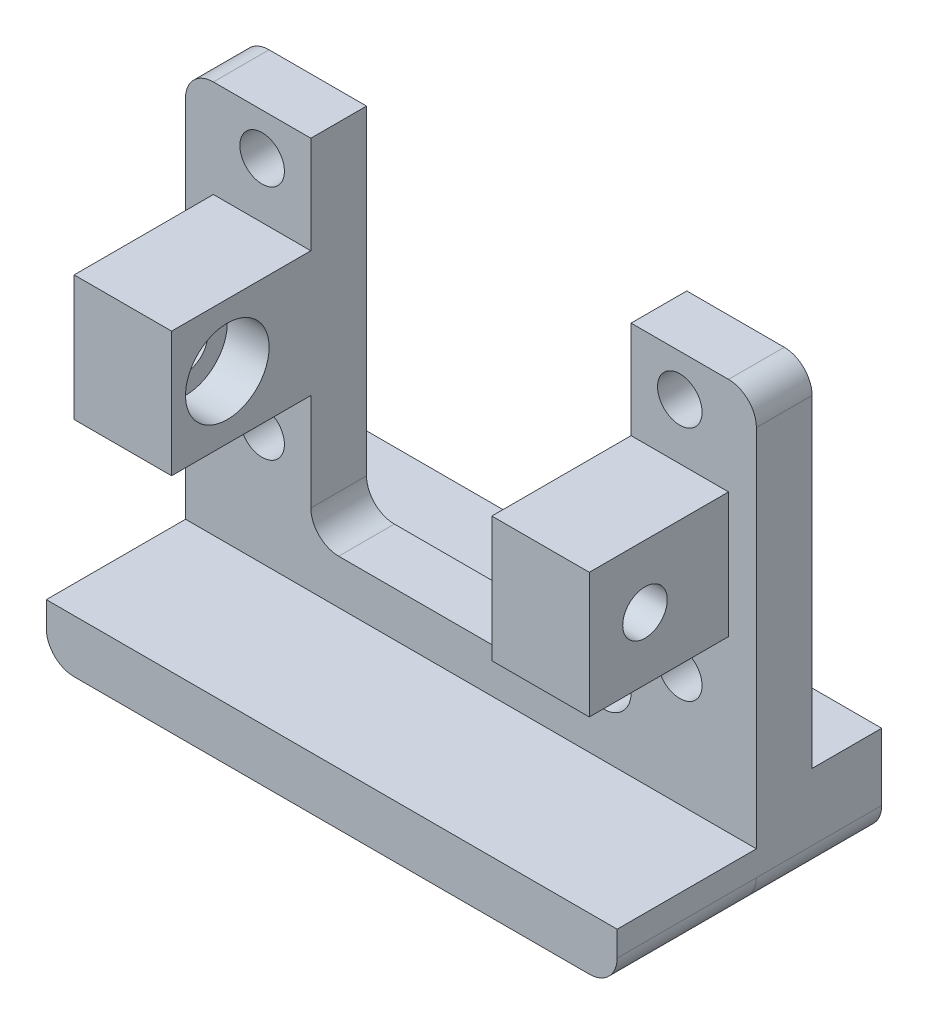
from build123d import *

# Parameters (mm, degrees)
EXTRUDE_5_DEPTH          = 3
EXTRUDE_5_DEPTH_BACK     = 1
SKETCH_1_R               = 1.6
SKETCH_6_W               = 7
SKETCH_6_H               = 9
EXTRUDE_6_DEPTH          = 10
CUT_EXTRUDE_3_DEPTH      = 48.647140523
CUT_EXTRUDE_3_DEPTH_BACK = 48.647140523
SKETCH_7_R               = 1.6
FILLET_1_R               = 2
EXTRUDE_START            = 5
EXTRUDE_7_DEPTH          = 5
SKETCH_9_R               = 3
CUT_EXTRUDE_4_DEPTH      = 3
CUT_EXTRUDE_START        = -3
SKETCH_10_R              = 3
CUT_EXTRUDE_5_DEPTH      = 3
SKETCH_11_W              = 41
SKETCH_11_H              = 3.8
EXTRUDE_8_DEPTH          = 10
FILLET_2_R               = 2


with BuildPart() as part:
    # 草图1 → 凸台-拉伸5 (new, two sides: drawn at the far end of the back side and taken through both)
    with BuildSketch(Plane.XY.offset(-EXTRUDE_5_DEPTH_BACK)):
        with BuildLine():
            Line((-11.5, -13.5), (-11.5, 11.5))
            Line((-11.5, 11.5), (-18.5, 11.5))
            ThreePointArc((-18.5, 11.5), (-19.914213562, 10.914213562), (-20.5, 9.5))
            Line((-20.5, 9.5), (-20.5, -18.5))
            ThreePointArc((-20.5, -18.5), (-19.914213562, -19.914213562), (-18.5, -20.5))
            Line((-18.5, -20.5), (18.5, -20.5))
            ThreePointArc((18.5, -20.5), (19.914213562, -19.914213562), (20.5, -18.5))
            Line((20.5, -18.5), (20.5, 9.5))
            ThreePointArc((20.5, 9.5), (19.914213562, 10.914213562), (18.5, 11.5))
            Line((18.5, 11.5), (11.5, 11.5))
            Line((11.5, 11.5), (11.5, -13.5))
            Line((11.5, -13.5), (-11.5, -13.5))
        make_face()
        with Locations((-15, 8.5)):
            Circle(SKETCH_1_R, mode=Mode.SUBTRACT)
        with Locations((-15, -8.5)):
            Circle(SKETCH_1_R, mode=Mode.SUBTRACT)
        with Locations((15, 8.5)):
            Circle(SKETCH_1_R, mode=Mode.SUBTRACT)
        with Locations((15, -8.5)):
            Circle(SKETCH_1_R, mode=Mode.SUBTRACT)
    extrude(amount=EXTRUDE_5_DEPTH + EXTRUDE_5_DEPTH_BACK)

    # 草图6 → 凸台-拉伸6 (add)
    with BuildSketch(Plane.XY.offset(3)):
        with Locations((-15, 0)):
            Rectangle(SKETCH_6_W, SKETCH_6_H)
        with Locations((15, 0)):
            Rectangle(SKETCH_6_W, SKETCH_6_H)
    extrude(amount=EXTRUDE_6_DEPTH)

    # 草图7 → 切除-拉伸3 (cut, two sides: drawn at the far end of the back side and taken through both)
    with BuildSketch(Plane.ZY.offset(20.5).offset(-CUT_EXTRUDE_3_DEPTH_BACK)):
        with Locations((9, 0)):
            Circle(SKETCH_7_R)
    extrude(amount=CUT_EXTRUDE_3_DEPTH + CUT_EXTRUDE_3_DEPTH_BACK, mode=Mode.SUBTRACT)

    # 圆角1
    fillet_1_edges = [part.edges().sort_by_distance(p)[0] for p in [
        (-11.5, -13.5, 1),
        (11.5, -13.5, 1),
    ]]
    fillet(fillet_1_edges, radius=FILLET_1_R)

    # 草图8 → 凸台-拉伸7 (add)
    with BuildSketch(Plane(origin=(0, 0, -1), x_dir=(-1, 0, 0), z_dir=(0, 0, -1)).offset(EXTRUDE_START)):
        with BuildLine():
            Line((-20.5, -18.5), (-20.5, -13.7))
            Line((-20.5, -13.7), (20.5, -13.7))
            Line((20.5, -13.7), (20.5, -18.5))
            ThreePointArc((20.5, -18.5), (19.914213562, -19.914213562), (18.5, -20.5))
            Line((18.5, -20.5), (-18.5, -20.5))
            ThreePointArc((-18.5, -20.5), (-19.914213562, -19.914213562), (-20.5, -18.5))
        make_face()
    extrude(amount=-EXTRUDE_7_DEPTH)

    # 草图9 → 切除-拉伸4 (cut)
    with BuildSketch(Plane.ZY.offset(-11.5)):
        with Locations(Location((9, 0, 0), (0, 0, 270))):
            Circle(SKETCH_9_R)
    extrude(amount=-CUT_EXTRUDE_4_DEPTH, mode=Mode.SUBTRACT)

    # 草图10 → 切除-拉伸5 (cut)
    with BuildSketch(Plane(origin=(-11.5, 0, 0), x_dir=(0, 0, -1), z_dir=(1, 0, 0)).offset(CUT_EXTRUDE_START)):
        with Locations(Location((-9, 0, 0), (0, 0, 270))):
            Circle(SKETCH_10_R)
    extrude(amount=CUT_EXTRUDE_5_DEPTH, mode=Mode.SUBTRACT)

    # 草图11 → 凸台-拉伸8 (add)
    with BuildSketch(Plane.XY.offset(3)):
        with Locations((0, -18.6)):
            Rectangle(SKETCH_11_W, SKETCH_11_H)
    extrude(amount=EXTRUDE_8_DEPTH)

    # 圆角2
    fillet_2_edges = [part.edges().sort_by_distance(p)[0] for p in [
        (-20.5, -20.5, 8),
        (20.5, -20.5, 8),
    ]]
    fillet(fillet_2_edges, radius=FILLET_2_R)


solid = part.part
